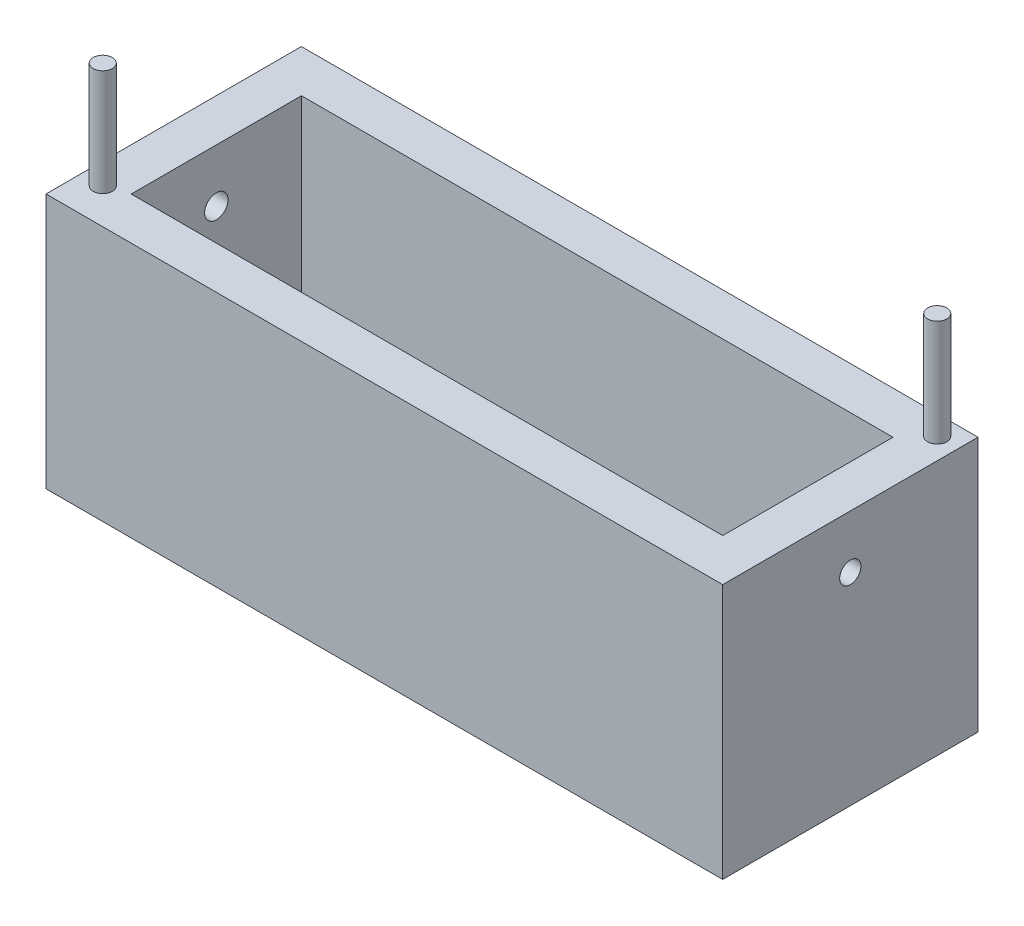
from build123d import *

# Parameters (mm, degrees)
SKETCH1_W           = 403.86
SKETCH1_H           = 152.4
BOSS_EXTRUDE1_DEPTH = 152.4
SKETCH2_W           = 353.06
SKETCH2_H           = 101.6
CUT_EXTRUDE2_DEPTH  = 139.7
SKETCH8_R           = 5.715
BOSS_EXTRUDE2_DEPTH = 63.5
SKETCH9_R           = 6.35
CUT_EXTRUDE3_DEPTH  = 302.26
SKETCH14_R          = 6.985
CUT_EXTRUDE4_DEPTH  = 68.58


with BuildPart() as part:
    # Sketch1 → Boss-Extrude1 (new body)
    with BuildSketch(Plane.XY):
        with Locations((201.93, 76.2)):
            Rectangle(SKETCH1_W, SKETCH1_H)
    extrude(amount=BOSS_EXTRUDE1_DEPTH)

    # Sketch2 → Cut-Extrude2 (cut)
    with BuildSketch(Plane(origin=(0, 152.4, 0), x_dir=(1, 0, 0), z_dir=(0, 1, 0))):
        with Locations((201.988879989, -76.2)):
            Rectangle(SKETCH2_W, SKETCH2_H)
    extrude(amount=-CUT_EXTRUDE2_DEPTH, mode=Mode.SUBTRACT)

    # Sketch8 → Boss-Extrude2 (add)
    with BuildSketch(Plane(origin=(0, 152.4, 0), x_dir=(1, 0, 0), z_dir=(0, 1, 0))):
        with Locations((12.758879989, -131.284542218)):
            Circle(SKETCH8_R)
        with Locations((391.218879989, -11.690207089)):
            Circle(SKETCH8_R)
    extrude(amount=BOSS_EXTRUDE2_DEPTH)

    # Sketch9 → Cut-Extrude3 (cut)
    with BuildSketch(Plane(origin=(403.86, 0, 0), x_dir=(0, 0, -1), z_dir=(1, 0, 0))):
        with Locations((-76.2, 120.65)):
            Circle(SKETCH9_R)
    extrude(amount=-CUT_EXTRUDE3_DEPTH, mode=Mode.SUBTRACT)

    # Sketch14 → Cut-Extrude4 (cut)
    with BuildSketch(Plane.ZY):
        with Locations((76.2, 120.65)):
            Circle(SKETCH14_R)
    extrude(amount=-CUT_EXTRUDE4_DEPTH, mode=Mode.SUBTRACT)


solid = part.part
